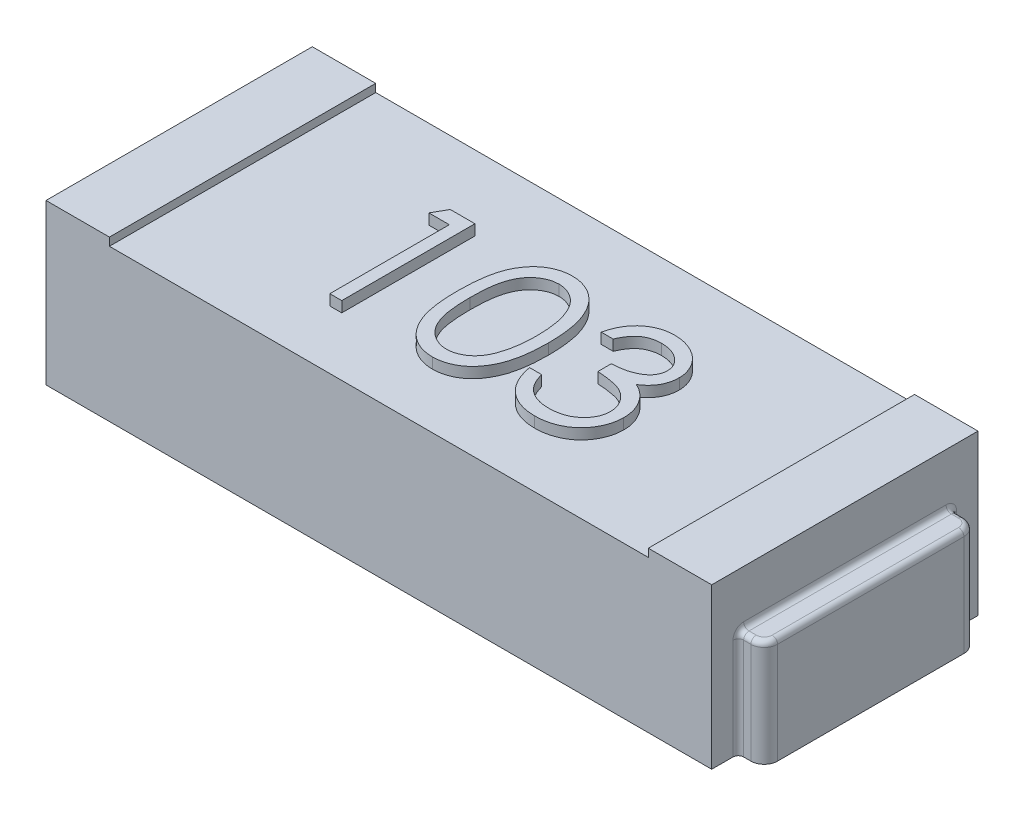
from build123d import *

# Parameters (mm, degrees)
ESQUISSE1_W             = 2.5
ESQUISSE1_H             = 1
BOSS_EXTRU_1_DEPTH      = 0.6
ESQUISSE2_W             = 2.023603034
ESQUISSE2_H             = 1
ENL_V_MAT_EXTRU_1_DEPTH = 0.03
BOSS_EXTRU_2_DEPTH      = 0.4
CONG_1_R                = 0.02
CONG_1_OF_SYM_TRIE2_R   = 0.02
BOSS_EXTRU_3_DEPTH      = 0.04


with BuildPart() as part:
    # Esquisse1 → Boss.-Extru.1 (new body)
    with BuildSketch(Plane(origin=(0, 0, 0), x_dir=(1, 0, 0), z_dir=(0, 1, 0))):
        Rectangle(ESQUISSE1_W, ESQUISSE1_H)
    extrude(amount=BOSS_EXTRU_1_DEPTH)

    # Esquisse2 → Enlèv. mat.-Extru.1 (cut)
    with BuildSketch(Plane(origin=(0, 0.6, 0), x_dir=(1, 0, 0), z_dir=(0, 1, 0))):
        Rectangle(ESQUISSE2_W, ESQUISSE2_H)
    extrude(amount=-ENL_V_MAT_EXTRU_1_DEPTH, mode=Mode.SUBTRACT)

    # Esquisse3 → Boss.-Extru.2 (add)
    with BuildSketch(Plane(origin=(0, 0, 0), x_dir=(1, 0, 0), z_dir=(0, 1, 0))):
        with BuildLine():
            Line((1.25, 0.4), (1.297141448, 0.4))
            ThreePointArc((1.297141448, 0.4), (1.332496787, 0.385355339), (1.347141448, 0.35))
            Line((1.347141448, 0.35), (1.347141448, -0.35))
            ThreePointArc((1.347141448, -0.35), (1.332496787, -0.385355339), (1.297141448, -0.4))
            Line((1.297141448, -0.4), (1.25, -0.4))
            Line((1.25, -0.4), (1.25, 0.4))
        make_face()
    boss_extru_2 = extrude(amount=BOSS_EXTRU_2_DEPTH)

    # Congé1
    cong_1_edges = [part.edges().sort_by_distance(p)[0] for p in [
        (1.25, 0.2, -0.4),
        (1.25, 0.2, 0.4),
        (1.25, 0.4, 0),
        (1.273570724, 0.4, 0.4),
        (1.332496787, 0.4, 0.385355339),
        (1.347141448, 0.4, 0),
        (1.332496787, 0.4, -0.385355339),
        (1.273570724, 0.4, -0.4),
    ]]
    fillet(cong_1_edges, radius=CONG_1_R)

    # Symétrie2: Boss.-Extru.2 across plane
    add(boss_extru_2.mirror(Plane(origin=(0, 0, 0), x_dir=(0, 0, 1), z_dir=(1, 0, 0))))

    # Congé1 of Symétrie2
    cong_1_of_sym_trie2_edges = [part.edges().sort_by_distance(p)[0] for p in [
        (-1.25, 0.2, -0.4),
        (-1.25, 0.2, 0.4),
        (-1.25, 0.4, 0),
        (-1.273570724, 0.4, 0.4),
        (-1.332496787, 0.4, 0.385355339),
        (-1.347141448, 0.4, 0),
        (-1.332496787, 0.4, -0.385355339),
        (-1.273570724, 0.4, -0.4),
    ]]
    fillet(cong_1_of_sym_trie2_edges, radius=CONG_1_OF_SYM_TRIE2_R)

    # Esquisse4 → Boss.-Extru.3 (add)
    # profile 1 of 3: a face of its own
    with BuildSketch(Plane(origin=(0, 0.57, 0), x_dir=(1, 0, 0), z_dir=(0, 1, 0))):
        with BuildLine():
            Line((0.275641026, 0.104315862), (0.230769231, 0.104315862))
            add(Edge.make_bspline(
                [(0.230769231, 0.104315862), (0.231984881, 0.109349074), (0.234361377, 0.119188592), (0.239318174, 0.133246772), (0.244718067, 0.146550132), (0.251202225, 0.158849571), (0.258274904, 0.170392272), (0.26637815, 0.180916432), (0.27513811, 0.190689713), (0.284827389, 0.199363033), (0.294988626, 0.207216994), (0.305765001, 0.213913431), (0.3169397, 0.219674024), (0.328590147, 0.224419771), (0.340751029, 0.227994846), (0.353312404, 0.230588676), (0.366307189, 0.23227312), (0.375128274, 0.232437515), (0.379607372, 0.23252099)],
                knots=[0, 0, 0, 0, 1.162005537, 2.271625781, 3.343758855, 4.383309926, 5.390229558, 6.379919256, 7.361854164, 8.333198761, 9.295911338, 10.242430842, 11.177959212, 12.116337295, 13.062827104, 14.020064771, 14.994644689, 16, 16, 16, 16], degree=3))
            add(Edge.make_bspline(
                [(0.379607372, 0.23252099), (0.386133478, 0.232323957), (0.399043337, 0.231934189), (0.418009486, 0.228374984), (0.436299032, 0.222742822), (0.453711781, 0.214960861), (0.469885843, 0.205362674), (0.484276727, 0.19393914), (0.496689371, 0.180910668), (0.507102854, 0.166520302), (0.515256425, 0.151140943), (0.521268764, 0.13531235), (0.524929004, 0.119072068), (0.52540337, 0.108106742), (0.525641026, 0.102613138)],
                knots=[0, 0, 0, 0, 1.083050992, 2.142477498, 3.193116406, 4.255571735, 5.30263384, 6.308962982, 7.297363603, 8.282367274, 9.249857812, 10.179914175, 11.08814088, 12, 12, 12, 12], degree=3))
            add(Edge.make_bspline(
                [(0.525641026, 0.102613138), (0.525474798, 0.097326453), (0.525149517, 0.086981231), (0.522387559, 0.07187816), (0.517739522, 0.057643645), (0.511300984, 0.044217765), (0.502966477, 0.031685645), (0.492870378, 0.020019089), (0.480941426, 0.009166352), (0.471901578, 0.002949285), (0.467247596, -0.000251446)],
                knots=[0, 0, 0, 0, 1.024540389, 2.004866551, 2.965041327, 3.920577974, 4.882998113, 5.874504559, 6.905732034, 8, 8, 8, 8], degree=3))
            add(Edge.make_bspline(
                [(0.467247596, -0.000251446), (0.472566418, -0.002819756), (0.483104543, -0.007908321), (0.497468904, -0.017887715), (0.510508601, -0.029410051), (0.517780561, -0.038401858), (0.521434295, -0.042919715)],
                knots=[0, 0, 0, 0, 1.015518401, 2.012035669, 3.001164323, 4, 4, 4, 4], degree=3))
            add(Edge.make_bspline(
                [(0.521434295, -0.042919715), (0.523840201, -0.046213679), (0.528612615, -0.052747668), (0.534503405, -0.063252871), (0.539847564, -0.073874513), (0.544011881, -0.084897285), (0.54723672, -0.09619343), (0.549541867, -0.107782343), (0.550973887, -0.119673489), (0.551178966, -0.127718129), (0.551282051, -0.131761862)],
                knots=[0, 0, 0, 0, 1.025084078, 2.033381695, 3.024893161, 4.013698104, 4.991890475, 5.976764909, 6.982997093, 8, 8, 8, 8], degree=3))
            add(Edge.make_bspline(
                [(0.551282051, -0.131761862), (0.551025692, -0.138763251), (0.55051418, -0.15273308), (0.54594217, -0.173372326), (0.538854564, -0.193547398), (0.528789287, -0.212843803), (0.516522501, -0.230898143), (0.501928597, -0.247051902), (0.485173396, -0.260937417), (0.466486875, -0.272538878), (0.446241571, -0.281812867), (0.424587915, -0.288249644), (0.401837907, -0.29244193), (0.386236864, -0.292891483), (0.378305288, -0.293120035)],
                knots=[0, 0, 0, 0, 0.955779014, 1.907060117, 2.875433937, 3.871313158, 4.872415639, 5.851225146, 6.836215519, 7.83643374, 8.849228613, 9.86973379, 10.916971861, 12, 12, 12, 12], degree=3))
            add(Edge.make_bspline(
                [(0.378305288, -0.293120035), (0.372959674, -0.292996005), (0.362441288, -0.292751954), (0.346977931, -0.291083583), (0.332217688, -0.288036439), (0.318140603, -0.283935967), (0.304734169, -0.278737147), (0.292039297, -0.272263047), (0.279977883, -0.264647118), (0.268663747, -0.255799463), (0.258098238, -0.245902128), (0.248562134, -0.234779413), (0.23989645, -0.222636926), (0.232333215, -0.209333633), (0.225527937, -0.195041453), (0.219930657, -0.179577382), (0.215004147, -0.163079664), (0.212713652, -0.151582844), (0.211538462, -0.145684138)],
                knots=[0, 0, 0, 0, 1.048658725, 2.063410685, 3.046034179, 4.001477787, 4.936774919, 5.862367409, 6.792675028, 7.730719943, 8.675894397, 9.627829632, 10.600096036, 11.597688215, 12.626045268, 13.701542398, 14.82072376, 16, 16, 16, 16], degree=3))
            Line((0.211538462, -0.145684138), (0.256410256, -0.145684138))
            add(Edge.make_bspline(
                [(0.256410256, -0.145684138), (0.257579298, -0.149533997), (0.259853186, -0.157022307), (0.2637238, -0.167799494), (0.268133553, -0.177679216), (0.272864204, -0.186733947), (0.277832553, -0.195052862), (0.283391828, -0.202415986), (0.289130278, -0.209146729), (0.2934559, -0.212938817), (0.295572917, -0.214794715)],
                knots=[0, 0, 0, 0, 1.198163088, 2.33053128, 3.407730985, 4.417276592, 5.372219308, 6.28897303, 7.162600585, 8, 8, 8, 8], degree=3))
            add(Edge.make_bspline(
                [(0.295572917, -0.214794715), (0.298372428, -0.216953048), (0.303962808, -0.221263053), (0.313072555, -0.226763286), (0.322653253, -0.231529146), (0.332912492, -0.235169674), (0.343628888, -0.238252197), (0.354975655, -0.240269414), (0.366852686, -0.241653439), (0.374962366, -0.241775572), (0.379106571, -0.241837984)],
                knots=[0, 0, 0, 0, 0.946170439, 1.889420265, 2.845303464, 3.807233317, 4.801018734, 5.828864929, 6.890507805, 8, 8, 8, 8], degree=3))
            add(Edge.make_bspline(
                [(0.379106571, -0.241837984), (0.383785642, -0.241749998), (0.392935163, -0.241577948), (0.406285857, -0.239995704), (0.418986921, -0.237691359), (0.430897339, -0.234132362), (0.442173126, -0.229735097), (0.452656219, -0.224213896), (0.462484234, -0.217736079), (0.471531292, -0.210373342), (0.479666365, -0.202313128), (0.486829152, -0.19388269), (0.49291839, -0.185117571), (0.497830329, -0.175969268), (0.501708979, -0.166475664), (0.504349437, -0.156610117), (0.506185367, -0.146453365), (0.506334883, -0.139549226), (0.506410256, -0.136068753)],
                knots=[0, 0, 0, 0, 1.217147791, 2.380027433, 3.494444702, 4.572153297, 5.609568379, 6.639424714, 7.649109417, 8.668170816, 9.669597737, 10.625200337, 11.543417969, 12.441394052, 13.322311151, 14.205496177, 15.095365482, 16, 16, 16, 16], degree=3))
            add(Edge.make_bspline(
                [(0.506410256, -0.136068753), (0.506191642, -0.131409991), (0.505755501, -0.122115647), (0.502425704, -0.108441707), (0.496948723, -0.095266934), (0.489281221, -0.082816107), (0.479947546, -0.071276693), (0.469038273, -0.060980767), (0.456462812, -0.052485039), (0.444888545, -0.046615231), (0.43463638, -0.042609935), (0.425862754, -0.039942083), (0.416040382, -0.037682989), (0.405288046, -0.035581236), (0.39352473, -0.033792472), (0.380763238, -0.032300784), (0.367000987, -0.031107207), (0.357473677, -0.030574193), (0.352564103, -0.030299523)],
                knots=[0, 0, 0, 0, 1.07054697, 2.135767047, 3.216561865, 4.33974944, 5.486079747, 6.621378074, 7.775625952, 8.963672916, 9.598146892, 10.304877434, 11.070270905, 11.915000392, 12.823868403, 13.805723172, 14.86925407, 16, 16, 16, 16], degree=3))
            Line((0.352564103, -0.030299523), (0.352564103, 0.020982529))
            add(Edge.make_bspline(
                [(0.352564103, 0.020982529), (0.358749983, 0.021087501), (0.370866604, 0.021293115), (0.388565791, 0.023779974), (0.40549055, 0.027220063), (0.421265798, 0.032489376), (0.435644186, 0.038609419), (0.448118415, 0.045731163), (0.458513722, 0.053647556), (0.466779589, 0.062480786), (0.47299805, 0.071954364), (0.477544736, 0.081828172), (0.480230497, 0.092188752), (0.48058902, 0.099259419), (0.480769231, 0.102813458)],
                knots=[0, 0, 0, 0, 1.321986639, 2.589447074, 3.816329219, 5.01088745, 6.139805852, 7.153945165, 8.075214402, 8.924034688, 9.728124013, 10.488707548, 11.240355623, 12, 12, 12, 12], degree=3))
            add(Edge.make_bspline(
                [(0.480769231, 0.102813458), (0.480710029, 0.105424565), (0.48059225, 0.110619237), (0.479106925, 0.118208533), (0.476874919, 0.125565811), (0.473806386, 0.132659783), (0.469699215, 0.139441251), (0.464784074, 0.14596803), (0.458931489, 0.152202855), (0.452224996, 0.158014329), (0.44502331, 0.163552792), (0.437130485, 0.16825474), (0.428784503, 0.172275463), (0.419976123, 0.175591106), (0.410676762, 0.17808529), (0.400930111, 0.179876125), (0.390717585, 0.18099579), (0.383750194, 0.181156992), (0.380208333, 0.181238939)],
                knots=[0, 0, 0, 0, 0.884392785, 1.759457502, 2.611959086, 3.489218968, 4.37281399, 5.2945488, 6.255912374, 7.266815255, 8.301784654, 9.332968512, 10.37626691, 11.440494194, 12.520033166, 13.637162961, 14.798855837, 16, 16, 16, 16], degree=3))
            add(Edge.make_bspline(
                [(0.380208333, 0.181238939), (0.374515238, 0.181040173), (0.363395298, 0.180651937), (0.347364596, 0.177251506), (0.332461834, 0.171826066), (0.321070596, 0.16534992), (0.3126588, 0.158957001), (0.306647808, 0.153373803), (0.300744878, 0.147169114), (0.295338353, 0.139960774), (0.289870642, 0.132236947), (0.284892848, 0.123604993), (0.280055749, 0.114290079), (0.277141099, 0.107704989), (0.275641026, 0.104315862)],
                knots=[0, 0, 0, 0, 1.472543308, 2.876219568, 4.221790263, 5.565193594, 6.249813518, 6.953379497, 7.687249741, 8.463570142, 9.283606569, 10.136032583, 11.040678096, 12, 12, 12, 12], degree=3))
        make_face()
    # profile 2 of 3: a face of its own
    with BuildSketch(Plane(origin=(0, 0.57, 0), x_dir=(1, 0, 0), z_dir=(0, 1, 0))):
        with BuildLine():
            add(Edge.make_bspline(
                [(-0.173076923, -0.030499843), (-0.173030063, -0.022485931), (-0.172939038, -0.00691879), (-0.171926406, 0.01576473), (-0.170244214, 0.037044772), (-0.167938875, 0.056922352), (-0.16513345, 0.075402605), (-0.16138838, 0.092436141), (-0.157129408, 0.108101799), (-0.152193345, 0.122450663), (-0.14662366, 0.13567605), (-0.140561623, 0.148022507), (-0.133766653, 0.159471354), (-0.126627094, 0.170205324), (-0.11885394, 0.180048709), (-0.110668399, 0.189140518), (-0.101750988, 0.197270626), (-0.092404844, 0.20467724), (-0.082545349, 0.211170022), (-0.07245354, 0.216888984), (-0.062059953, 0.22177468), (-0.051336213, 0.225616171), (-0.040378704, 0.228789149), (-0.029149123, 0.230958998), (-0.017628929, 0.232324271), (-0.009853009, 0.232454795), (-0.005909455, 0.23252099)],
                knots=[0, 0, 0, 0, 1.646270934, 3.197905019, 4.663502075, 6.030701355, 7.308322542, 8.50163776, 9.611534131, 10.641858119, 11.616356847, 12.558055219, 13.465016945, 14.349605745, 15.204443733, 16.039544428, 16.859896111, 17.680448484, 18.487036065, 19.28249412, 20.06191084, 20.843045899, 21.620316918, 22.403196591, 23.190181807, 24, 24, 24, 24], degree=3))
            add(Edge.make_bspline(
                [(-0.005909455, 0.23252099), (-0.001932958, 0.232451302), (0.005975043, 0.232312715), (0.017666525, 0.230980723), (0.029087908, 0.228770563), (0.0401905, 0.225638995), (0.051065498, 0.221753898), (0.061627842, 0.21688431), (0.071943139, 0.211215901), (0.081847466, 0.204555347), (0.091449554, 0.197129307), (0.100513548, 0.18873464), (0.109040275, 0.179456109), (0.117136747, 0.169392986), (0.124573261, 0.158352259), (0.13165518, 0.146525958), (0.137994042, 0.133707263), (0.144098996, 0.120110053), (0.149368565, 0.105358102), (0.154120886, 0.089534565), (0.157960739, 0.072452538), (0.161159206, 0.054201646), (0.163637048, 0.034714862), (0.165441712, 0.01403396), (0.16639501, -0.007854667), (0.166574538, -0.022820074), (0.166666667, -0.030499843)],
                knots=[0, 0, 0, 0, 0.810914788, 1.612654377, 2.396697861, 3.181598691, 3.963628158, 4.749916497, 5.551656086, 6.361998678, 7.18212741, 8.025565596, 8.878627764, 9.750805457, 10.657531673, 11.591944965, 12.560506719, 13.57287815, 14.630710178, 15.753379473, 16.941251878, 18.199788006, 19.531962791, 20.947069417, 22.433333509, 24, 24, 24, 24], degree=3))
            add(Edge.make_bspline(
                [(0.166666667, -0.030499843), (0.166573583, -0.038146116), (0.166392214, -0.053044566), (0.165452398, -0.074834705), (0.163601165, -0.095405854), (0.161285453, -0.114807349), (0.158078172, -0.132958437), (0.154134577, -0.14992193), (0.14975596, -0.165771083), (0.144350989, -0.180376056), (0.138435173, -0.193940588), (0.131998717, -0.206607324), (0.125103027, -0.218488222), (0.117590349, -0.229488186), (0.109582719, -0.239685137), (0.100908749, -0.248899083), (0.091812951, -0.257352037), (0.082182606, -0.264873698), (0.072123813, -0.271457241), (0.061843945, -0.277344934), (0.051160605, -0.282092462), (0.040315897, -0.286168896), (0.029154702, -0.289283247), (0.017690932, -0.291436655), (0.005982898, -0.292946919), (-0.001931611, -0.29306213), (-0.005909455, -0.293120035)],
                knots=[0, 0, 0, 0, 1.561518951, 3.042555995, 4.452378317, 5.7783523, 7.031515105, 8.214008947, 9.334062868, 10.386615937, 11.391082383, 12.354592575, 13.286541444, 14.194233754, 15.072674879, 15.931287219, 16.775624067, 17.606195743, 18.42308326, 19.229000347, 20.022332153, 20.807536673, 21.593273796, 22.3848459, 23.188221202, 24, 24, 24, 24], degree=3))
            add(Edge.make_bspline(
                [(-0.005909455, -0.293120035), (-0.0098529, -0.293053413), (-0.017628604, -0.292922047), (-0.029150379, -0.291562943), (-0.040333585, -0.289377871), (-0.051233407, -0.286318356), (-0.061905766, -0.282573379), (-0.072205236, -0.277694282), (-0.082246333, -0.272075129), (-0.09200227, -0.265675783), (-0.101289721, -0.258344114), (-0.110160951, -0.25023493), (-0.118393096, -0.241145871), (-0.12605511, -0.231220454), (-0.133337123, -0.22054999), (-0.140035605, -0.208988794), (-0.146231441, -0.196582707), (-0.151894797, -0.183251577), (-0.156916034, -0.168800873), (-0.161351421, -0.153065276), (-0.164853444, -0.135905899), (-0.167851009, -0.117460561), (-0.170268778, -0.09765), (-0.171919396, -0.07646346), (-0.172939583, -0.053914145), (-0.173030308, -0.038447034), (-0.173076923, -0.030499843)],
                knots=[0, 0, 0, 0, 0.810891512, 1.598919785, 2.382837074, 3.152667961, 3.926044502, 4.706494248, 5.493654104, 6.291793342, 7.103789334, 7.925228297, 8.761435821, 9.622817696, 10.50288917, 11.416980706, 12.369136599, 13.353924996, 14.394355917, 15.514179734, 16.714354668, 17.994756427, 19.357759367, 20.818452758, 22.365282078, 24, 24, 24, 24], degree=3))
        make_face()
        with BuildLine():
            add(Edge.make_bspline(
                [(-0.128205128, -0.030299523), (-0.128188064, -0.036977908), (-0.128154947, -0.049939343), (-0.127289775, -0.068774095), (-0.126111171, -0.086341285), (-0.124590985, -0.102663218), (-0.122333421, -0.117684649), (-0.11980388, -0.131508889), (-0.116725582, -0.14406278), (-0.113083436, -0.155432467), (-0.108934994, -0.165810906), (-0.104405585, -0.175468222), (-0.099539767, -0.184518499), (-0.094094174, -0.192880443), (-0.088163451, -0.200581323), (-0.081881557, -0.207757442), (-0.075014045, -0.214157011), (-0.06551351, -0.221832276), (-0.052971157, -0.229763581), (-0.037168234, -0.236670165), (-0.020929884, -0.241010516), (-0.009908277, -0.241562481), (-0.004407051, -0.241837984)],
                knots=[0, 0, 0, 0, 1.459021318, 2.831673884, 4.118529203, 5.306027144, 6.411944654, 7.436330062, 8.375795394, 9.233974572, 10.042671642, 10.816086306, 11.563610507, 12.285937304, 12.993564865, 13.685989202, 14.367179055, 15.041617293, 16.353048772, 17.594441528, 18.799311195, 20, 20, 20, 20], degree=3))
            add(Edge.make_bspline(
                [(-0.004407051, -0.241837984), (0.001129759, -0.24160973), (0.012191948, -0.241153692), (0.028353919, -0.236753873), (0.044043957, -0.230115367), (0.056339949, -0.222265723), (0.065694598, -0.214790248), (0.072397025, -0.208416726), (0.078548746, -0.201280174), (0.084383328, -0.193580275), (0.089734625, -0.18516992), (0.094600787, -0.176089552), (0.099041266, -0.166313955), (0.101571129, -0.159489707), (0.102864583, -0.156000644)],
                knots=[0, 0, 0, 0, 1.353760809, 2.704726607, 4.075137775, 5.516104923, 6.260822281, 7.007110065, 7.778089737, 8.566572457, 9.372053459, 10.217411131, 11.088608312, 12, 12, 12, 12], degree=3))
            add(Edge.make_bspline(
                [(0.102864583, -0.156000644), (0.104371979, -0.151539253), (0.107432638, -0.142480715), (0.111377177, -0.128428765), (0.114483663, -0.113685513), (0.117278429, -0.098339068), (0.119186009, -0.082276253), (0.12072141, -0.06554677), (0.121625794, -0.048138004), (0.121737902, -0.036310148), (0.121794872, -0.030299523)],
                knots=[0, 0, 0, 0, 0.884706709, 1.796334032, 2.740027952, 3.714592787, 4.726048262, 5.777819803, 6.87074269, 8, 8, 8, 8], degree=3))
            add(Edge.make_bspline(
                [(0.121794872, -0.030299523), (0.121716273, -0.024289869), (0.121562518, -0.012533703), (0.120974805, 0.00468318), (0.119457152, 0.021035717), (0.117771564, 0.036594356), (0.115286246, 0.051272971), (0.11260656, 0.065194443), (0.109006386, 0.078186304), (0.105160704, 0.090451958), (0.100759219, 0.101852052), (0.095914114, 0.112439736), (0.090739577, 0.122266125), (0.085119257, 0.131304259), (0.079119874, 0.139594623), (0.072583081, 0.146970993), (0.065768171, 0.153661989), (0.056222858, 0.161299499), (0.043726531, 0.169086884), (0.028177153, 0.176253421), (0.011995633, 0.180368891), (0.001056568, 0.180949132), (-0.004407051, 0.181238939)],
                knots=[0, 0, 0, 0, 1.31362396, 2.569729283, 3.763502607, 4.902122613, 5.988968491, 7.01645872, 7.998833611, 8.933434873, 9.825090667, 10.667526885, 11.477055099, 12.250526234, 12.991942729, 13.710640831, 14.402115721, 15.076753259, 16.378508321, 17.609869233, 18.806226677, 20, 20, 20, 20], degree=3))
            add(Edge.make_bspline(
                [(-0.004407051, 0.181238939), (-0.009937136, 0.180948732), (-0.02100738, 0.18036779), (-0.037357087, 0.176268754), (-0.053029138, 0.169124045), (-0.06549242, 0.161273706), (-0.075044389, 0.153796804), (-0.081770488, 0.147313025), (-0.088077084, 0.140220703), (-0.093886756, 0.132449001), (-0.099328082, 0.124096805), (-0.104325369, 0.11509841), (-0.108827845, 0.105408216), (-0.112982779, 0.095034439), (-0.116636034, 0.083665733), (-0.119649458, 0.071127305), (-0.122433322, 0.057347035), (-0.124404075, 0.042244248), (-0.12615604, 0.025918226), (-0.127281947, 0.008307181), (-0.128157841, -0.01055916), (-0.12818905, -0.023587611), (-0.128205128, -0.030299523)],
                knots=[0, 0, 0, 0, 1.207732386, 2.417664972, 3.655092373, 4.956220595, 5.625982001, 6.301752483, 6.994047911, 7.697131622, 8.419323945, 9.170223765, 9.943494443, 10.752040957, 11.610060368, 12.549350801, 13.567764191, 14.679664412, 15.874934091, 17.154273443, 18.533957287, 20, 20, 20, 20], degree=3))
        make_face(mode=Mode.SUBTRACT)
    # profile 3 of 3: a face of its own
    with BuildSketch(Plane(origin=(0, 0.57, 0), x_dir=(1, 0, 0), z_dir=(0, 1, 0))):
        Polygon((-0.451422276, 0.219700477), (-0.358974359, 0.219700477), (-0.358974359, -0.280299523), (-0.403846154, -0.280299523), (-0.403846154, 0.168418426), (-0.480769231, 0.168418426), align=None)
    extrude(amount=BOSS_EXTRU_3_DEPTH)


solid = part.part
